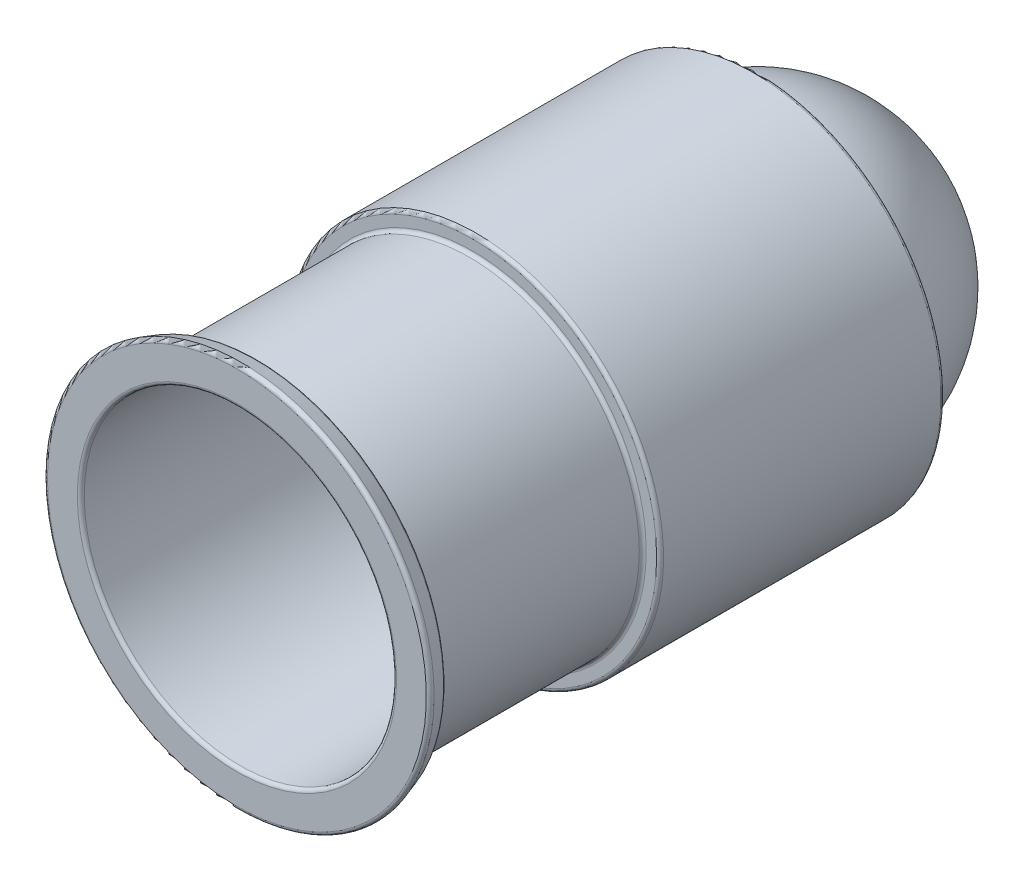
from build123d import *


with BuildPart() as part:
    # Esquisse1 → Révolution1 (revolve)
    with BuildSketch(Plane(origin=(0, 0, 0), x_dir=(1, 0, 0), z_dir=(0, 1, 0))):
        with BuildLine():
            Line((4, 0), (-0.306287057, 0))
            ThreePointArc((-0.306287057, 0), (-0.711908149, 0.207644858), (-0.780628706, 0.658113883))
            Line((-0.780628706, 0.658113883), (-0.113962039, 2.658113883))
            ThreePointArc((-0.113962039, 2.658113883), (0.068024468, 2.905621093), (0.36037961, 3))
            Line((0.36037961, 3), (2, 3))
            ThreePointArc((2, 3), (2.353553391, 3.146446609), (2.5, 3.5))
            Line((2.5, 3.5), (2.5, 33.5))
            ThreePointArc((2.5, 33.5), (2.353553391, 33.853553391), (2, 34))
            Line((2, 34), (0.5, 34))
            ThreePointArc((0.5, 34), (0.146446609, 34.146446609), (0, 34.5))
            Line((0, 34.5), (0, 74.5))
            ThreePointArc((0, 74.5), (0.146446609, 74.853553391), (0.5, 75))
            Line((0.5, 75), (4.005435425, 75))
            ThreePointArc((4.005435425, 75), (4.355124728, 75.1426243), (4.505317263, 75.489130435))
            ThreePointArc((4.505317263, 75.489130435), (7.191319286, 85.670809171), (14.215909091, 93.515318513))
            ThreePointArc((14.215909091, 93.515318513), (14.732330094, 93.54661153), (15, 93.10386699))
            Line((15, 93.10386699), (15, 91.248076809))
            ThreePointArc((15, 91.248076809), (14.948574979, 91.027213757), (14.804878049, 90.851782253))
            ThreePointArc((14.804878049, 90.851782253), (8.646945468, 82.947665653), (7.095409012, 73.048780488))
            ThreePointArc((7.095409012, 73.048780488), (6.968192836, 72.664135626), (6.597794237, 72.5))
            Line((6.597794237, 72.5), (5, 72.5))
            ThreePointArc((5, 72.5), (4.646446609, 72.353553391), (4.5, 72))
            Line((4.5, 72), (4.5, 0.5))
            ThreePointArc((4.5, 0.5), (4.353553391, 0.146446609), (4, 0))
        make_face()
    revolve(axis=Axis((27, 0, -75), (0, 0, 1)))


solid = part.part
